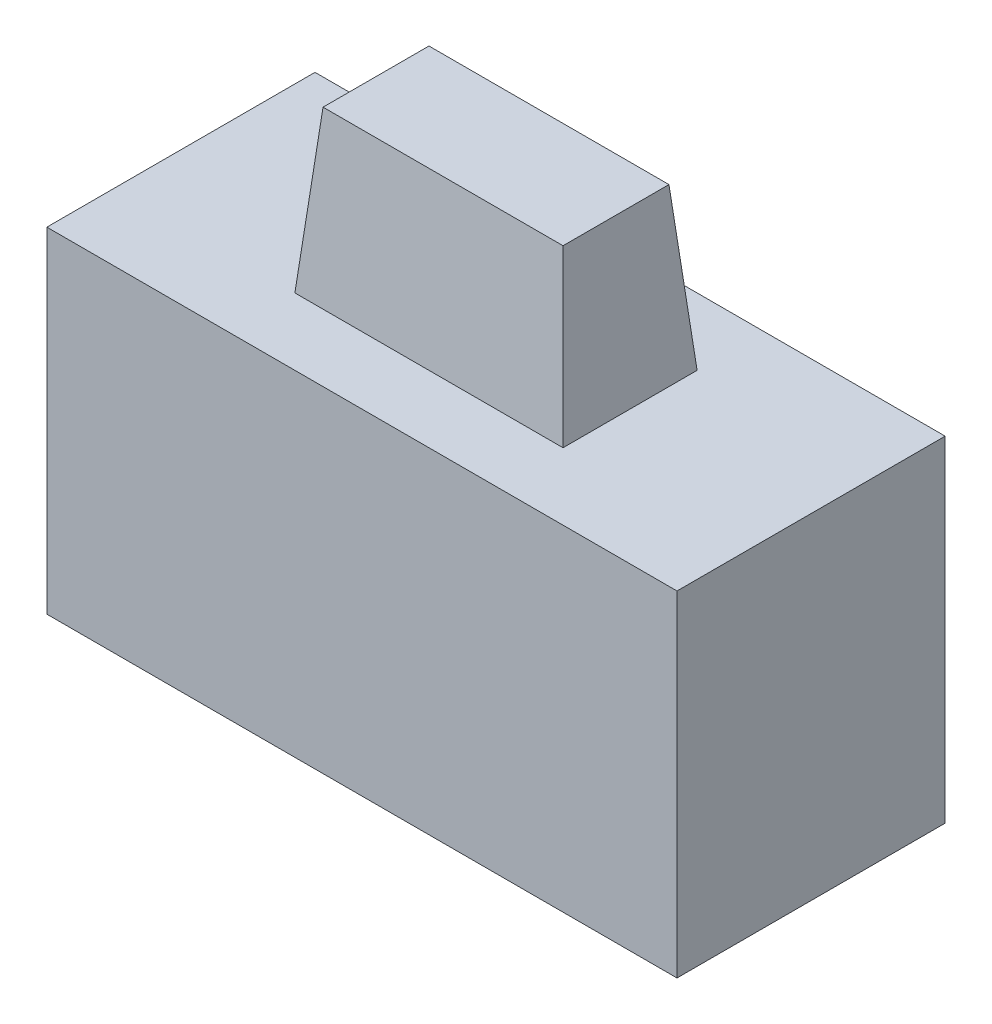
from build123d import *

# Parameters (mm, degrees)
SKETCH1_W           = 4.7
SKETCH1_H           = 2.5
BOSS_EXTRUDE1_DEPTH = 2
SKETCH2_W           = 2
SKETCH2_H           = 1
BOSS_EXTRUDE2_DEPTH = 1.2
BOSS_EXTRUDE2_TAPER = 5


with BuildPart() as part:
    # Sketch1 → Boss-Extrude1 (new body)
    with BuildSketch(Plane.XY):
        with Locations((0, -1.25)):
            Rectangle(SKETCH1_W, SKETCH1_H)
    extrude(amount=BOSS_EXTRUDE1_DEPTH)

    # Sketch2 → Boss-Extrude2 (add)
    with BuildSketch(Plane(origin=(0, 0, 0), x_dir=(1, 0, 0), z_dir=(0, 1, 0))):
        with Locations((0, -1)):
            Rectangle(SKETCH2_W, SKETCH2_H)
    extrude(amount=BOSS_EXTRUDE2_DEPTH, taper=BOSS_EXTRUDE2_TAPER)


solid = part.part
